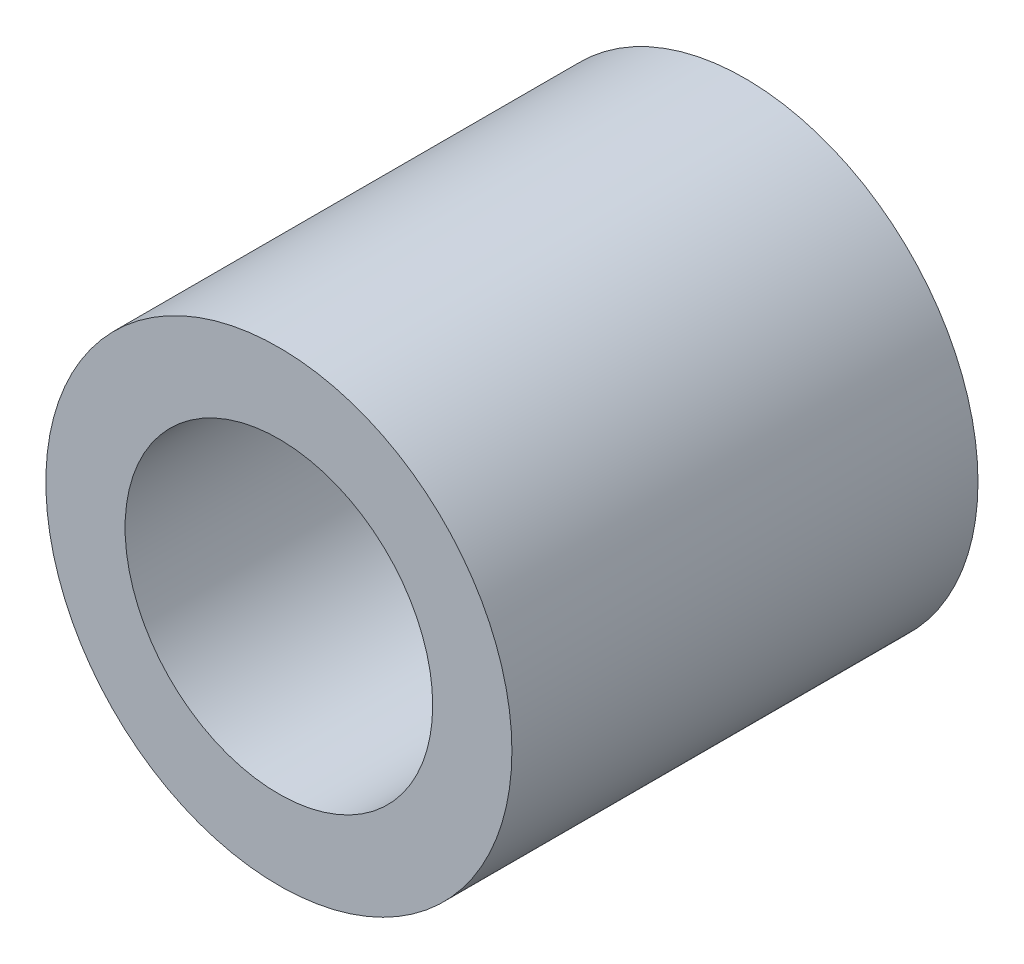
from build123d import *

# Parameters (mm, degrees)
SKETCH_1_R      = 25
SKETCH_1_R_2    = 16.5
EXTRUDE_1_DEPTH = 50


with BuildPart() as part:
    # 草图1 → 凸台-拉伸1 (new body)
    with BuildSketch(Plane.XY):
        Circle(SKETCH_1_R)
        Circle(SKETCH_1_R_2, mode=Mode.SUBTRACT)
    extrude(amount=EXTRUDE_1_DEPTH)


solid = part.part
